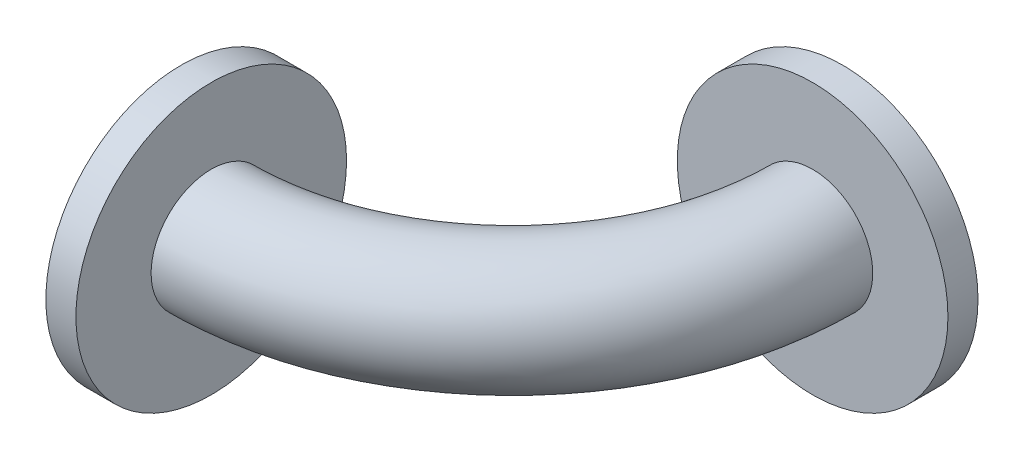
from build123d import *

# Parameters (mm, degrees)
SWEEP_2_PROFILE_R = 8
SKETCH_9_R        = 18
EXTRUDE_3_DEPTH   = 4
SKETCH_10_R       = 18
EXTRUDE_4_DEPTH   = 4


with BuildPart() as part:
    # 扫描2: sweep along a path in 草图1
    with BuildLine(Plane(origin=(0, 0, 0), x_dir=(1, 0, 0), z_dir=(0, 1, 0))) as sweep_2_path:
        ThreePointArc((40, 0), (28.2843, -28.2843), (0, -40))
    # 扫描2 profile (on start of the path) → 扫描2 (sweep)
    with BuildSketch(Plane(origin=(40, 0, 0), x_dir=(0.9999999999969885, 0, -2.454181391155847e-06), z_dir=(2.454181391155847e-06, 0, 0.9999999999969885))):
        Circle(SWEEP_2_PROFILE_R)
    sweep(path=sweep_2_path.line)

    # 草图9 → 凸台-拉伸3 (add)
    with BuildSketch(Plane.XY):
        with Locations((40, 0)):
            Circle(SKETCH_9_R)
    extrude(amount=-EXTRUDE_3_DEPTH)

    # 草图10 → 凸台-拉伸4 (add)
    with BuildSketch(Plane(origin=(0, 0, 0), x_dir=(0, 0, -1), z_dir=(1, 0, 0))):
        with Locations((-40, 0)):
            Circle(SKETCH_10_R)
    extrude(amount=-EXTRUDE_4_DEPTH)


solid = part.part
